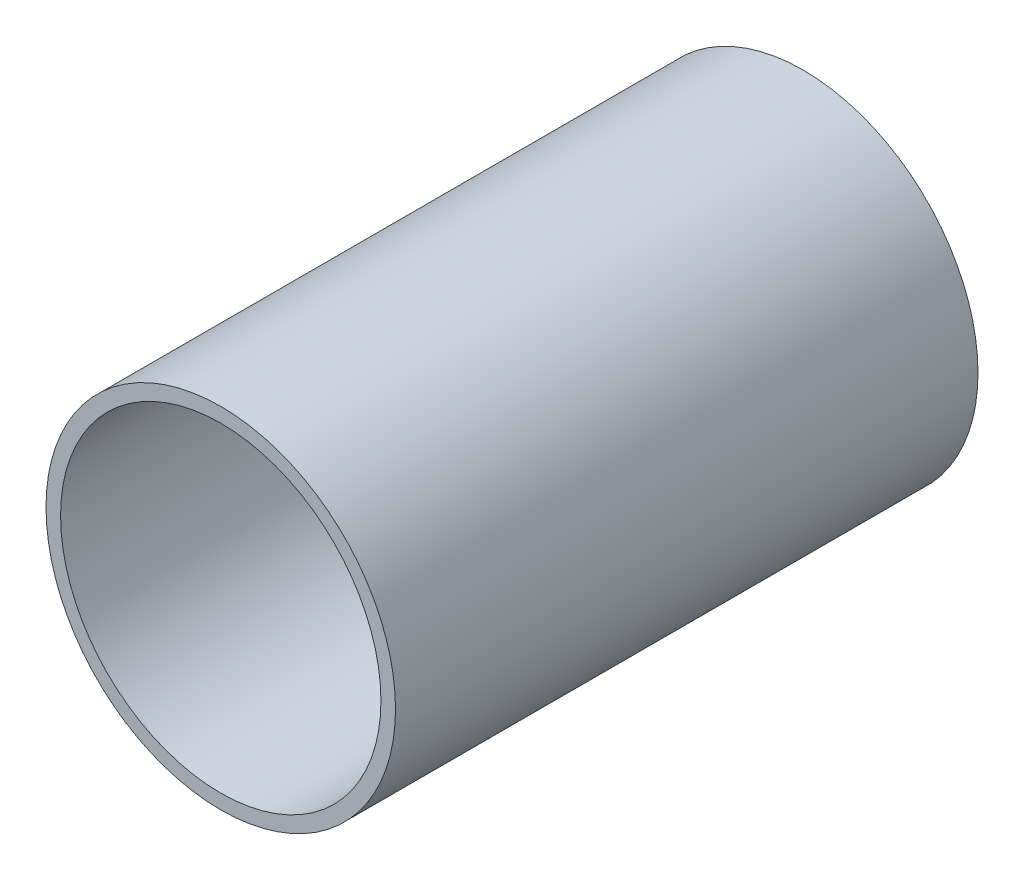
from build123d import *

# Parameters (mm, degrees)
ESQUISSE1_R             = 24
BOSS_EXTRU_2_DEPTH      = 80
ESQUISSE2_R             = 22
ENL_V_MAT_EXTRU_1_DEPTH = 80


with BuildPart() as part:
    # Esquisse1 → Boss.-Extru.2 (new body)
    with BuildSketch(Plane.XY):
        Circle(ESQUISSE1_R)
    extrude(amount=BOSS_EXTRU_2_DEPTH)

    # Esquisse2 → Enlèv. mat.-Extru.1 (cut)
    with BuildSketch(Plane.XY.offset(80)):
        Circle(ESQUISSE2_R)
    extrude(amount=-ENL_V_MAT_EXTRU_1_DEPTH, mode=Mode.SUBTRACT)


solid = part.part
